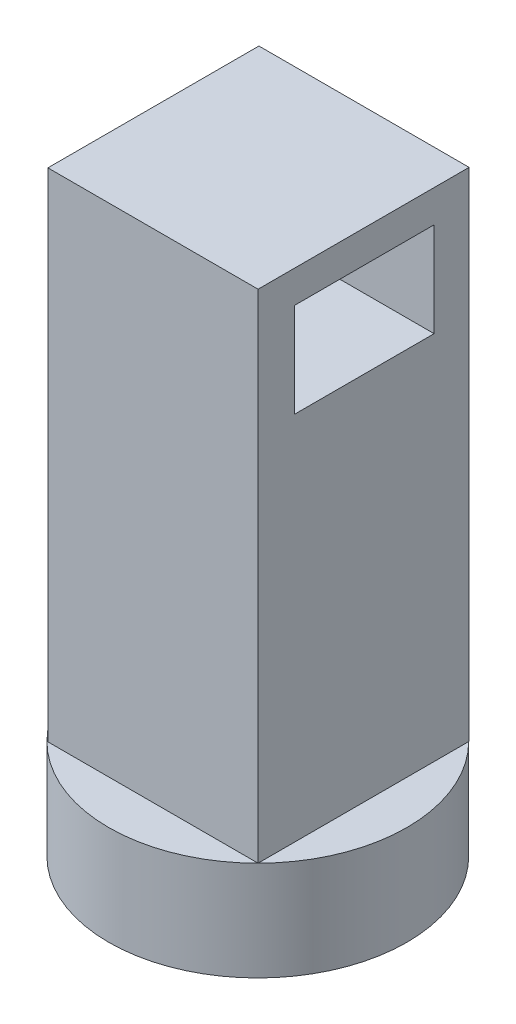
from build123d import *

# Parameters (mm, degrees)
SKETCH1_R           = 3.81
BOSS_EXTRUDE1_DEPTH = 2.54
SKETCH2_R           = 1.905
CUT_EXTRUDE2_DEPTH  = 1.27
SKETCH3_W           = 5.369563314
SKETCH3_H           = 5.391171223
BOSS_EXTRUDE2_DEPTH = 12.7
SKETCH4_W           = 3.561314924
SKETCH4_H           = 2.408690502
CUT_EXTRUDE3_DEPTH  = 12.7


with BuildPart() as part:
    # Sketch1 → Boss-Extrude1 (new body)
    with BuildSketch(Plane(origin=(0, 0, 0), x_dir=(1, 0, 0), z_dir=(0, 1, 0))):
        with Locations(Location((0, 0, 0), (0, 0, 270))):
            Circle(SKETCH1_R)
    extrude(amount=BOSS_EXTRUDE1_DEPTH)

    # Sketch2 → Cut-Extrude2 (cut)
    with BuildSketch(Plane.XZ):
        with Locations(Location((0, 0, 0), (0, 0, 270))):
            Circle(SKETCH2_R)
    extrude(amount=-CUT_EXTRUDE2_DEPTH, mode=Mode.SUBTRACT)

    # Sketch3 → Boss-Extrude2 (add)
    with BuildSketch(Plane(origin=(0, 2.54, 0), x_dir=(1, 0, 0), z_dir=(0, 1, 0))):
        with Locations((0.012751297, 0.004969332)):
            Rectangle(SKETCH3_W, SKETCH3_H)
    extrude(amount=BOSS_EXTRUDE2_DEPTH)

    # Sketch4 → Cut-Extrude3 (cut)
    with BuildSketch(Plane(origin=(2.697532954, 0, 0), x_dir=(0, 0, -1), z_dir=(1, 0, 0))):
        with Locations((0.026120509, 13.211421801)):
            Rectangle(SKETCH4_W, SKETCH4_H)
    extrude(amount=-CUT_EXTRUDE3_DEPTH, mode=Mode.SUBTRACT)


solid = part.part
